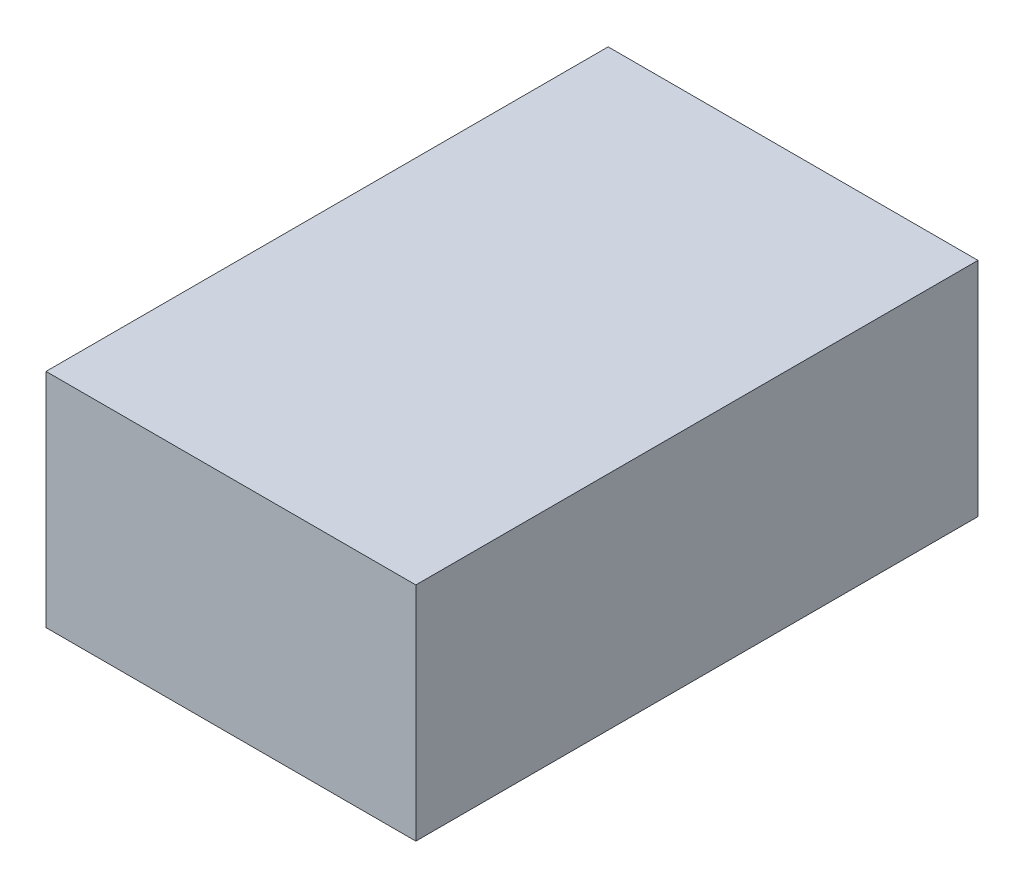
from build123d import *

# Parameters (mm, degrees)
SKETCH1_W           = 63.5
SKETCH1_H           = 96.52
BOSS_EXTRUDE1_DEPTH = 38.1


with BuildPart() as part:
    # Sketch1 → Boss-Extrude1 (new body)
    with BuildSketch(Plane(origin=(0, 0, 0), x_dir=(1, 0, 0), z_dir=(0, 1, 0))):
        with Locations((31.75, 48.26)):
            Rectangle(SKETCH1_W, SKETCH1_H)
    extrude(amount=BOSS_EXTRUDE1_DEPTH)


solid = part.part
